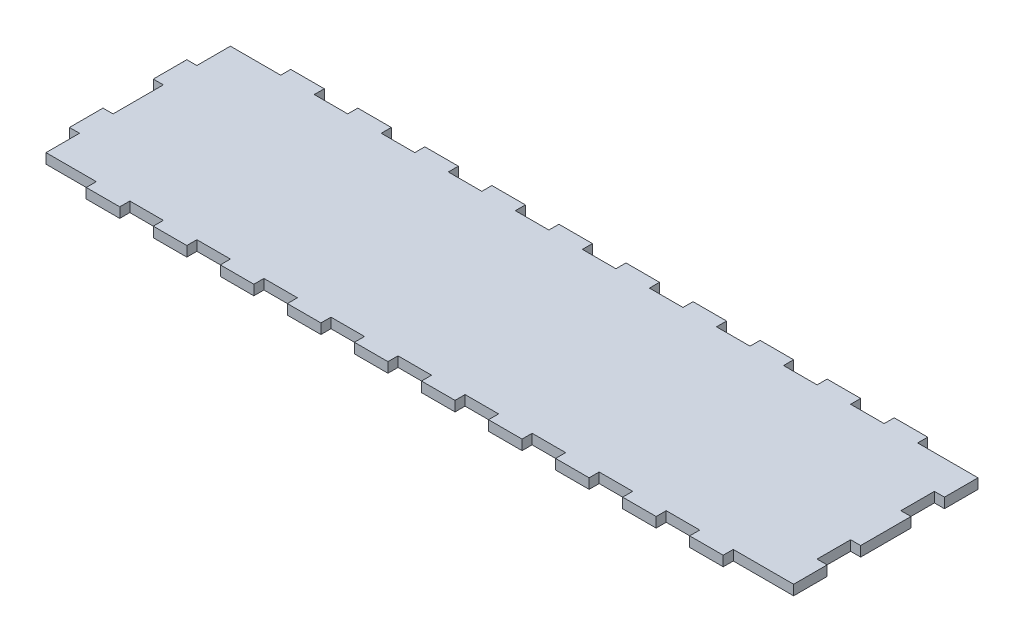
from build123d import *

# Parameters (mm, degrees)
EXTRUDE_2_DEPTH = 3


with BuildPart() as part:
    # Эскиз3 → Бобышка-Вытянуть2 (new body)
    with BuildSketch(Plane(origin=(0, 0, 0), x_dir=(1, 0, 0), z_dir=(0, 1, 0))):
        Polygon((-75, 27.5), (-75, 30.5), (-65, 30.5), (-65, 27.5), (-55, 27.5), (-55, 30.5), (-45, 30.5), (-45, 27.5), (-35, 27.5), (-35, 30.5), (-25, 30.5), (-25, 27.5), (-15, 27.5), (-15, 30.5), (-5, 30.5), (-5, 27.5), (5, 27.5), (5, 30.5), (15, 30.5), (15, 27.5), (25, 27.5), (25, 30.5), (35, 30.5), (35, 27.5), (45, 27.5), (45, 30.5), (55, 30.5), (55, 27.5), (65, 27.5), (65, 30.5), (75, 30.5), (75, 27.5), (85, 27.5), (85, 30.5), (95, 30.5), (95, 27.5), (110, 27.5), (113, 27.5), (113, 17.5), (110, 17.5), (110, 7.5), (113, 7.5), (113, -7.5), (110, -7.5), (110, -17.5), (113, -17.5), (113, -27.5), (110, -27.5), (95, -27.5), (95, -30.5), (85, -30.5), (85, -27.5), (75, -27.5), (75, -30.5), (65, -30.5), (65, -27.5), (55, -27.5), (55, -30.5), (45, -30.5), (45, -27.5), (35, -27.5), (35, -30.5), (25, -30.5), (25, -27.5), (15, -27.5), (15, -30.5), (5, -30.5), (5, -27.5), (-5, -27.5), (-5, -30.5), (-15, -30.5), (-15, -27.5), (-25, -27.5), (-25, -30.5), (-35, -30.5), (-35, -27.5), (-45, -27.5), (-45, -30.5), (-55, -30.5), (-55, -27.5), (-65, -27.5), (-65, -30.5), (-75, -30.5), (-75, -27.5), (-85, -27.5), (-85, -30.5), (-95, -30.5), (-95, -27.5), (-110, -27.5), (-110, -17.5), (-113, -17.5), (-113, -7.5), (-110, -7.5), (-110, 7.5), (-113, 7.5), (-113, 17.5), (-110, 17.5), (-110, 27.5), (-95, 27.5), (-95, 30.5), (-85, 30.5), (-85, 27.5), align=None)
    extrude(amount=EXTRUDE_2_DEPTH)


solid = part.part
